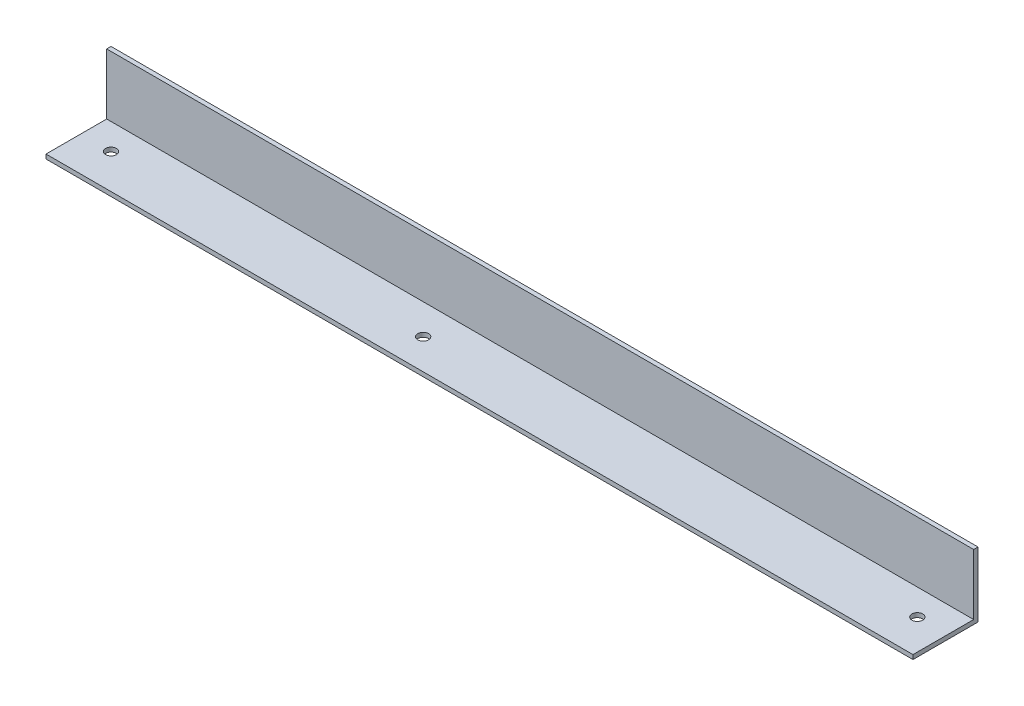
from build123d import *

# Parameters (mm, degrees)
SKETCH_1_W      = 200
SKETCH_1_H      = 15
EXTRUDE_1_DEPTH = 1
SKETCH_2_W      = 200
SKETCH_2_H      = 1
EXTRUDE_2_DEPTH = 14
M3X0_5_1_D      = 2.5
M3X0_5_2_D      = 2.5


with BuildPart() as part:
    # ｽｹｯﾁ1 → ﾎﾞｽ - 押し出し1 (new body)
    with BuildSketch(Plane.XY):
        with Locations((100, 7.5)):
            Rectangle(SKETCH_1_W, SKETCH_1_H)
    extrude(amount=EXTRUDE_1_DEPTH)

    # ｽｹｯﾁ2 → ﾎﾞｽ - 押し出し2 (add)
    with BuildSketch(Plane.XY.offset(1)):
        with Locations((100, 0.5)):
            Rectangle(SKETCH_2_W, SKETCH_2_H)
    extrude(amount=EXTRUDE_2_DEPTH)

    # M3x0.5 ねじ穴1 (through all)
    with Locations(Plane(origin=(0, 0, 0), x_dir=(-1, 0, 0), z_dir=(0, -1, 0))):
        with Locations((-193, -7)):
            m3x0_5_1 = Hole(M3X0_5_1_D / 2)

    # M3x0.5 ねじ穴2 (through all)
    with Locations(Plane(origin=(0, 1, 0), x_dir=(1, 0, 0), z_dir=(0, 1, 0))):
        with Locations((80, -8)):
            Hole(M3X0_5_2_D / 2)

    # ﾐﾗｰ1: M3x0.5 ねじ穴1 across plane
    add(m3x0_5_1.mirror(Plane(origin=(100, 0, 0), x_dir=(0, 0, 1), z_dir=(1, 0, 0))), mode=Mode.SUBTRACT)


solid = part.part
